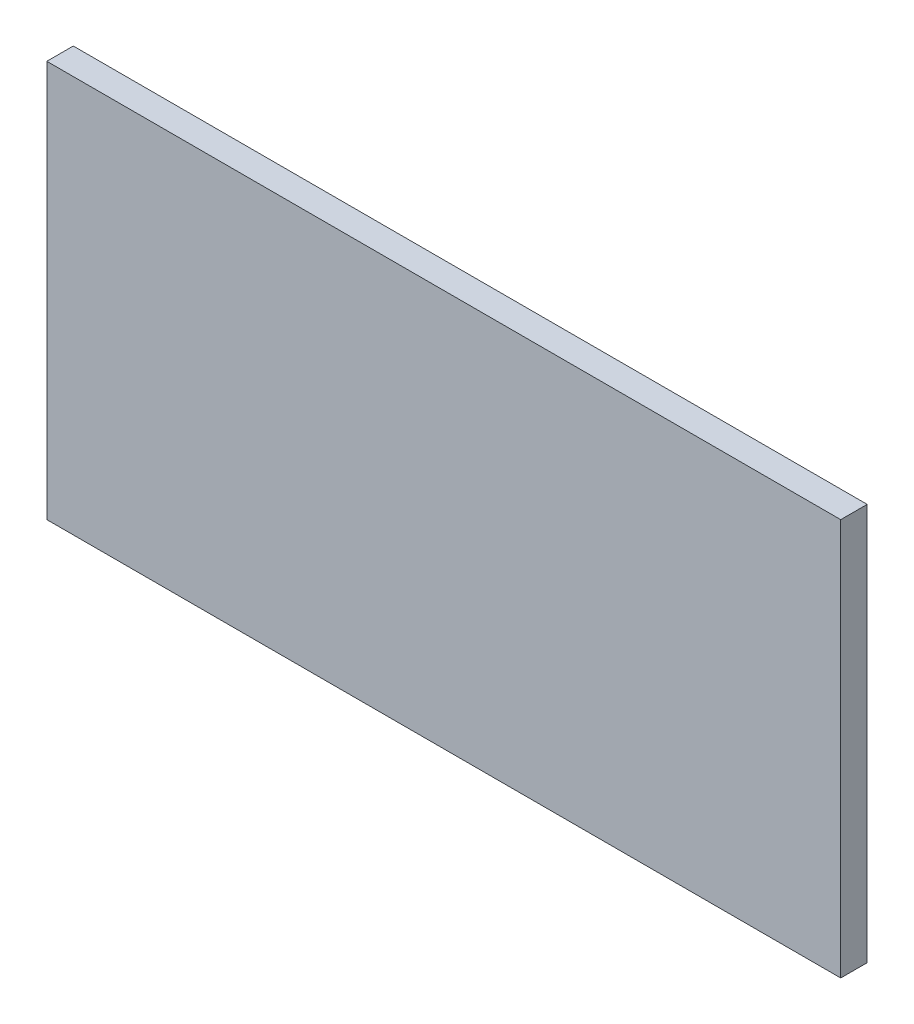
from build123d import *

# Parameters (mm, degrees)
SKETCH1_W           = 150
SKETCH1_H           = 75
BOSS_EXTRUDE1_DEPTH = 5
SKETCH2_W           = 7.5
SKETCH2_H           = 7.5
BOSS_EXTRUDE2_DEPTH = 2
SKETCH3_W           = 4
SKETCH3_H           = 7.5
BOSS_EXTRUDE3_DEPTH = 7
FILLET1_R           = 2
SKETCH6_R           = 2
CUT_EXTRUDE1_DEPTH  = 5


with BuildPart() as part:
    # Sketch1 → Boss-Extrude1 (new body)
    with BuildSketch(Plane.XY):
        Rectangle(SKETCH1_W, SKETCH1_H)
    extrude(amount=BOSS_EXTRUDE1_DEPTH)

    # Sketch2 → Boss-Extrude2 (add)
    with BuildSketch(Plane(origin=(0, 0, 0), x_dir=(-1, 0, 0), z_dir=(0, 0, -1))):
        Rectangle(SKETCH2_W, SKETCH2_H)
    extrude(amount=BOSS_EXTRUDE2_DEPTH)

    # Sketch3 → Boss-Extrude3 (add)
    with BuildSketch(Plane(origin=(0, 0, -2), x_dir=(-1, 0, 0), z_dir=(0, 0, -1))):
        Rectangle(SKETCH3_W, SKETCH3_H)
    extrude(amount=BOSS_EXTRUDE3_DEPTH)

    # Fillet1
    fillet1_edges = [part.edges().sort_by_distance(p)[0] for p in [
        (0, 3.75, -9),
        (0, -3.75, -9),
    ]]
    fillet(fillet1_edges, radius=FILLET1_R)

    # Sketch6 → Cut-Extrude1 (cut)
    with BuildSketch(Plane(origin=(2, 0, 0), x_dir=(0, 0, -1), z_dir=(1, 0, 0))):
        with Locations((6, 0)):
            Circle(SKETCH6_R)
    extrude(amount=-CUT_EXTRUDE1_DEPTH, mode=Mode.SUBTRACT)


solid = part.part
